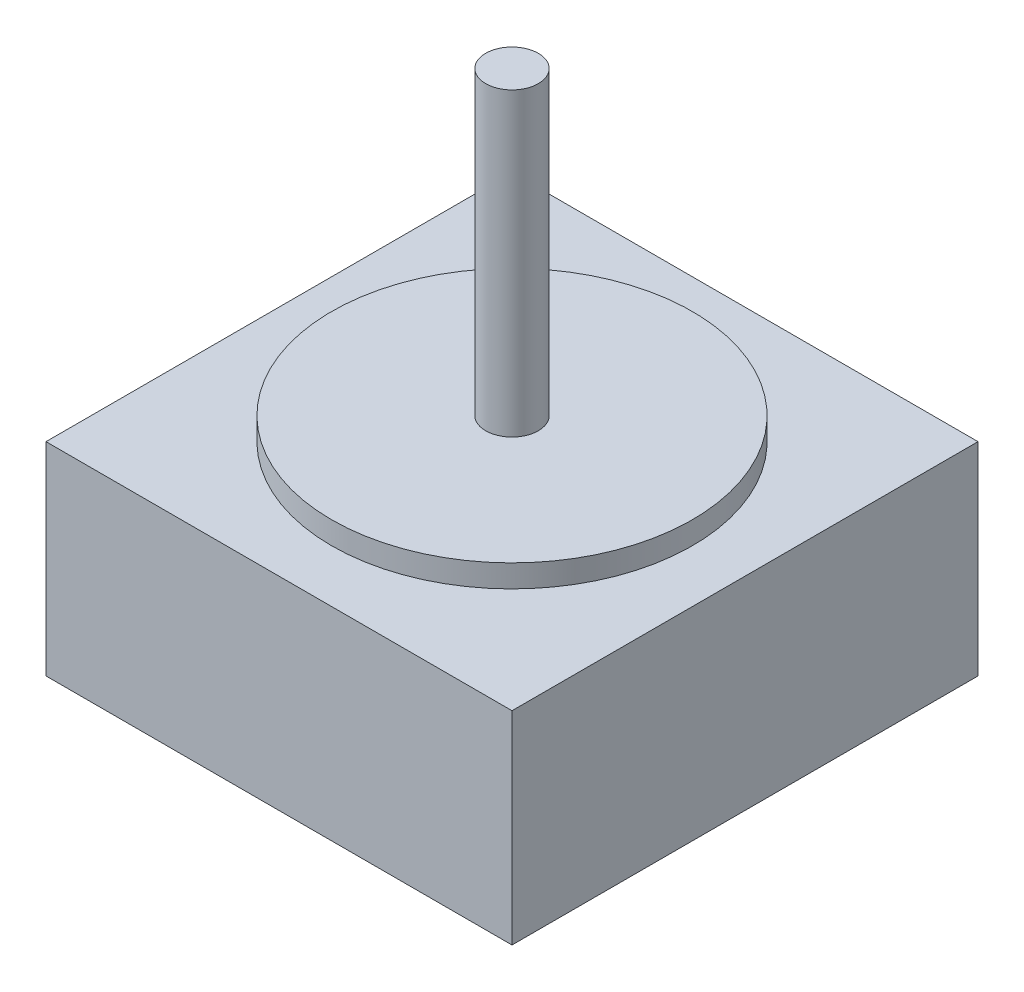
from build123d import *

# Parameters (mm, degrees)
ESQUISSE2_W        = 62
ESQUISSE2_H        = 62
BOSS_EXTRU_1_DEPTH = 27
ESQUISSE3_R        = 24
BOSS_EXTRU_2_DEPTH = 3
ESQUISSE4_R        = 3.5
BOSS_EXTRU_3_DEPTH = 40


with BuildPart() as part:
    # Esquisse2 → Boss.-Extru.1 (new body)
    with BuildSketch(Plane(origin=(0, 0, 0), x_dir=(1, 0, 0), z_dir=(0, 1, 0))):
        Rectangle(ESQUISSE2_W, ESQUISSE2_H)
    extrude(amount=BOSS_EXTRU_1_DEPTH)

    # Esquisse3 → Boss.-Extru.2 (add)
    with BuildSketch(Plane(origin=(0, 27, 0), x_dir=(1, 0, 0), z_dir=(0, 1, 0))):
        with Locations(Location((0, 0, 0), (0, 0, 270))):
            Circle(ESQUISSE3_R)
    extrude(amount=BOSS_EXTRU_2_DEPTH)

    # Esquisse4 → Boss.-Extru.3 (add)
    with BuildSketch(Plane(origin=(0, 30, 0), x_dir=(1, 0, 0), z_dir=(0, 1, 0))):
        with Locations(Location((0, 0, 0), (0, 0, 270))):
            Circle(ESQUISSE4_R)
    extrude(amount=BOSS_EXTRU_3_DEPTH)


solid = part.part
